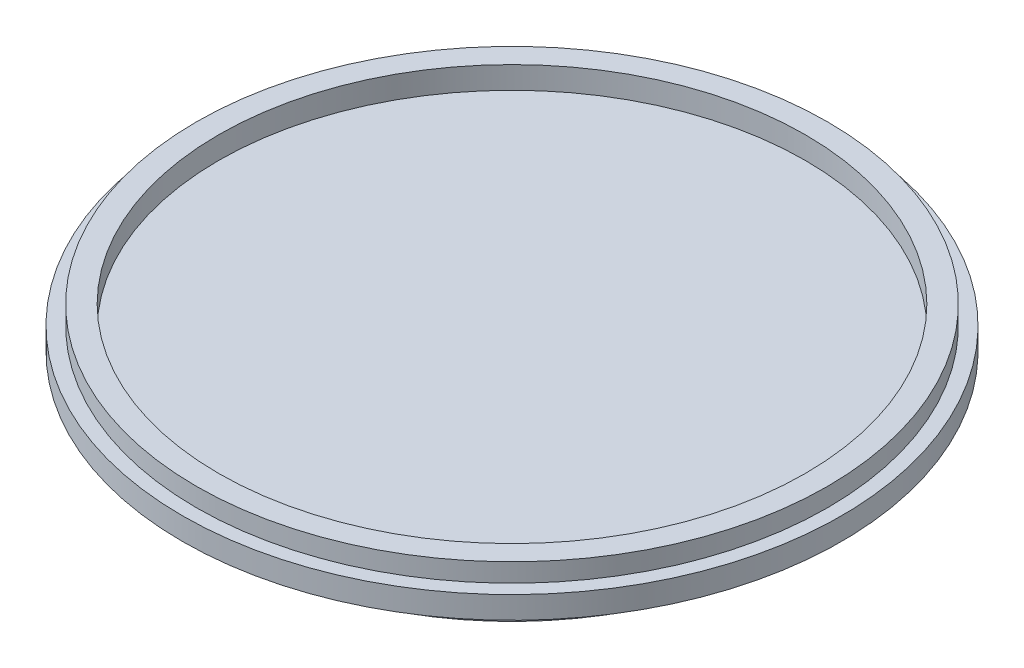
from build123d import *

# Parameters (mm, degrees)
SKETCH_1_R          = 17
SKETCH_1_R_2        = 15.8
EXTRUDE_1_DEPTH     = 1
EXTRUDE_START       = 1.2
SKETCH_2_R          = 17.75
SKETCH_2_R_2        = 15.8
EXTRUDE_2_DEPTH     = 1.2
SKETCH_3_R          = 16.75
SKETCH_3_R_2        = 15.8
CUT_EXTRUDE_1_DEPTH = 0.5
SKETCH_4_R          = 15.8
SKETCH_4_R_2        = 15
EXTRUDE_3_DEPTH     = 0.5
SKETCH_6_R          = 15
EXTRUDE_4_DEPTH     = 3


with BuildPart() as part:
    # 草图1 → 凸台-拉伸1 (new body)
    with BuildSketch(Plane(origin=(0, 0, 0), x_dir=(1, 0, 0), z_dir=(0, 1, 0))):
        Circle(SKETCH_1_R)
        Circle(SKETCH_1_R_2, mode=Mode.SUBTRACT)
    extrude(amount=EXTRUDE_1_DEPTH)

    # 草图2 → 凸台-拉伸2 (add)
    with BuildSketch(Plane.XZ.offset(EXTRUDE_START)):
        Circle(SKETCH_2_R)
        Circle(SKETCH_2_R_2, mode=Mode.SUBTRACT)
    extrude(amount=-EXTRUDE_2_DEPTH)

    # 草图3 → 切除-拉伸1 (cut)
    with BuildSketch(Plane(origin=(0, -1.2, 0), x_dir=(-1, 0, 0), z_dir=(0, -1, 0))):
        Circle(SKETCH_3_R)
        Circle(SKETCH_3_R_2, mode=Mode.SUBTRACT)
    extrude(amount=-CUT_EXTRUDE_1_DEPTH, mode=Mode.SUBTRACT)



with BuildPart() as body_2:
    # 草图4 → 凸台-拉伸3 (new body)
    with BuildSketch(Plane.XZ.offset(0.7)):
        Circle(SKETCH_4_R)
        Circle(SKETCH_4_R_2, mode=Mode.SUBTRACT)
    extrude(amount=-EXTRUDE_3_DEPTH)


with BuildPart() as part_1:
    add(part.part)

    add(body_2.part)  # 凸台-拉伸4 merges body 2
    # 草图6 → 凸台-拉伸4 (add)
    with BuildSketch(Plane(origin=(0, -0.2, 0), x_dir=(1, 0, 0), z_dir=(0, 1, 0))):
        Circle(SKETCH_6_R)
    extrude(amount=-EXTRUDE_4_DEPTH)


solid = part_1.part
